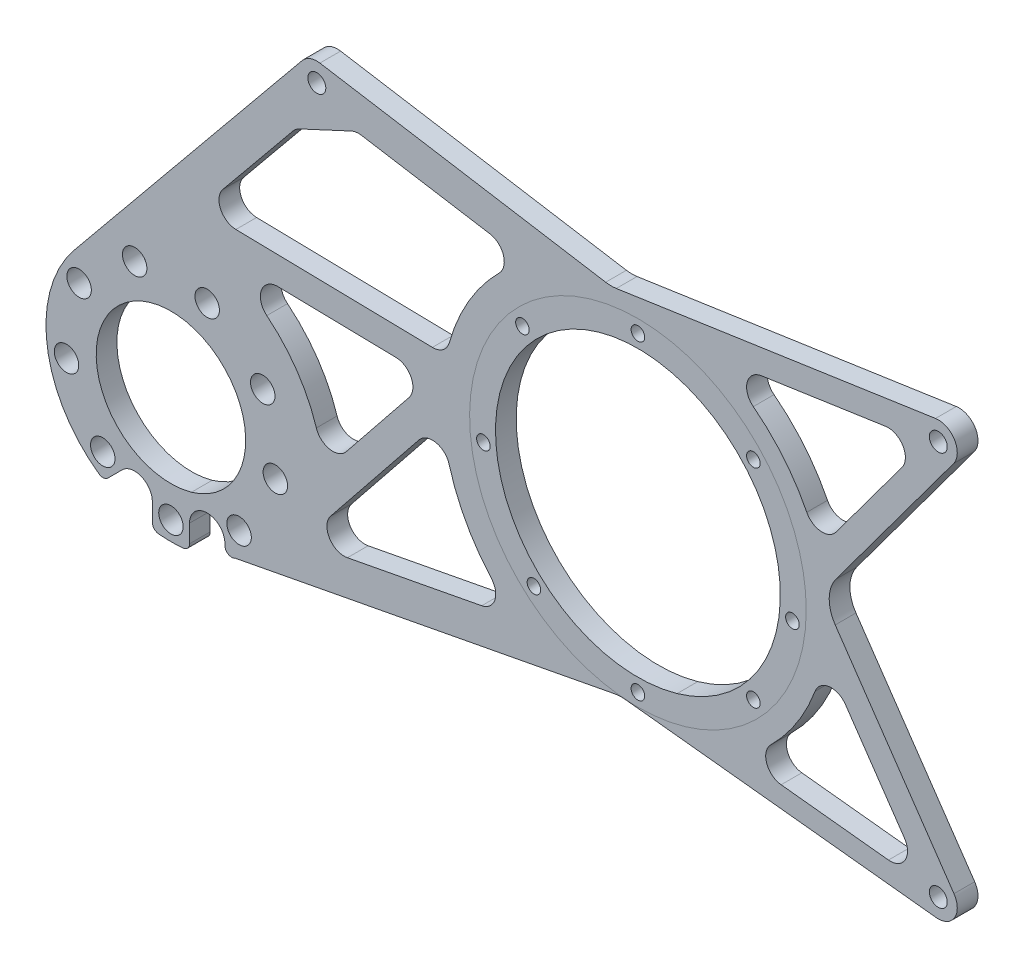
from build123d import *

# Parameters (mm, degrees)
SKETCH15_R          = 4.5
SKETCH15_R_2        = 27.4955
SKETCH15_R_3        = 2.5
SKETCH15_R_4        = 52.3875
SKETCH15_R_5        = 3.3
BOSS_EXTRUDE1_DEPTH = 7.62
PROFILE_DEPTH       = 804.110776731
PROF_FILLET_R       = 12.7
CUT_EXTRUDE2_DEPTH  = 804.110776731
FILLET2_R           = 6.35
CUT_EXTRUDE4_DEPTH  = 804.110776731
FILLET5_R           = 6.35


with BuildPart() as part:
    # Sketch15 → Boss-Extrude1 (new body)
    with BuildSketch(Plane(origin=(0, 0, 0), x_dir=(-1, 0, 0), z_dir=(0, 0, 1))):
        with BuildLine():
            ThreePointArc((-468.520845097, 164.597881552), (-470.201009111, 165.051242365), (-471.778645707, 164.316701751))
            Line((-471.778645707, 164.316701751), (-477.043529325, 159.051818133))
            ThreePointArc((-477.043529325, 159.051818133), (-484.127165713, 157.642795249), (-488.139723403, 163.648012211))
            Line((-488.139723403, 163.648012211), (-488.139723403, 170.220745001))
            ThreePointArc((-488.139723403, 170.220745001), (-488.796888696, 171.925600851), (-490.428332433, 172.748273949))
            ThreePointArc((-490.428332433, 172.748273949), (-494.978508993, 172.974), (-499.528685552, 172.748273949))
            ThreePointArc((-499.528685552, 172.748273949), (-501.160129289, 171.925600851), (-501.817294582, 170.220745001))
            Line((-501.817294582, 170.220745001), (-501.817294582, 163.648012211))
            ThreePointArc((-501.817294582, 163.648012211), (-508.317294582, 157.148012211), (-514.817294582, 163.648012211))
            Line((-514.817294582, 163.648012211), (-514.817294582, 164.225022653))
            ThreePointArc((-514.817294582, 164.225022653), (-516.106794745, 166.435870942), (-518.665995494, 166.401924563))
            Line((-518.665995494, 166.401924563), (-660.126842441, 139.458698233))
            Line((-660.126842441, 139.458698233), (-776.492771968, 151.978917225))
            ThreePointArc((-776.492771968, 151.978917225), (-781.907485254, 150.230614898), (-784.225, 145.034))
            Line((-784.225, 145.034), (-784.225, 0))
            ThreePointArc((-784.225, 0), (-782.179140867, -4.939140867), (-777.24, -6.985))
            Line((-777.24, -6.985), (-548.64, -6.985))
            ThreePointArc((-548.64, -6.985), (-545.651186694, -6.313257481), (-543.237237519, -4.427231931))
            Line((-543.237237519, -4.427231931), (-459.418508663, 97.860764379))
            ThreePointArc((-459.418508663, 97.860764379), (-449.426249212, 133.212914363), (-468.520845097, 164.597881552))
        make_face()
        with Locations((-508.317294582, 90.351987789)):
            Circle(SKETCH15_R, mode=Mode.SUBTRACT)
        with Locations((-481.639723403, 90.351987789)):
            Circle(SKETCH15_R, mode=Mode.SUBTRACT)
        with Locations((-528.75349974, 107.5)):
            Circle(SKETCH15_R, mode=Mode.SUBTRACT)
        with Locations((-461.203518245, 107.5)):
            Circle(SKETCH15_R, mode=Mode.SUBTRACT)
        with Locations((-533.38601136, 133.772278929)):
            Circle(SKETCH15_R, mode=Mode.SUBTRACT)
        with Locations((-494.978508993, 127)):
            Circle(SKETCH15_R_2, mode=Mode.SUBTRACT)
        with Locations((-456.571006625, 133.772278929)):
            Circle(SKETCH15_R, mode=Mode.SUBTRACT)
        with Locations((-520.04722577, 156.875733282)):
            Circle(SKETCH15_R, mode=Mode.SUBTRACT)
        with Locations((-494.978508993, 166)):
            Circle(SKETCH15_R, mode=Mode.SUBTRACT)
        with Locations((-469.909792215, 156.875733282)):
            Circle(SKETCH15_R, mode=Mode.SUBTRACT)
        with Locations((-609.91307368, 83.875279047)):
            Circle(SKETCH15_R_3, mode=Mode.SUBTRACT)
        with Locations((-666.75, 135.051477371)):
            Circle(SKETCH15_R_3, mode=Mode.SUBTRACT)
        with Locations((-666.75, 20.751477371)):
            Circle(SKETCH15_R_3, mode=Mode.SUBTRACT)
        with Locations((-709.220726776, 39.660663218)):
            Circle(SKETCH15_R_3, mode=Mode.SUBTRACT)
        with Locations((-624.279273224, 39.660663218)):
            Circle(SKETCH15_R_3, mode=Mode.SUBTRACT)
        with Locations((-666.75, 77.901477371)):
            Circle(SKETCH15_R_4, mode=Mode.SUBTRACT)
        with Locations((-723.58692632, 83.875279047)):
            Circle(SKETCH15_R_3, mode=Mode.SUBTRACT)
        with Locations((-709.220726776, 116.142291524)):
            Circle(SKETCH15_R_3, mode=Mode.SUBTRACT)
        with Locations((-628.509185847, 120.372204147)):
            Circle(SKETCH15_R_3, mode=Mode.SUBTRACT)
        with Locations((-548.64, 0)):
            Circle(SKETCH15_R_5, mode=Mode.SUBTRACT)
        with Locations((-777.24, 0)):
            Circle(SKETCH15_R_5, mode=Mode.SUBTRACT)
        with Locations((-777.24, 145.034)):
            Circle(SKETCH15_R_5, mode=Mode.SUBTRACT)
    extrude(amount=BOSS_EXTRUDE1_DEPTH)

    # Sketch18 → Profile (cut, through all)
    with BuildSketch(Plane.XY.offset(7.62)):
        with BuildLine():
            Line((656.843849148, -10.682497906), (776.22161066, 6.910362375))
            ThreePointArc((776.22161066, 6.910362375), (776.729439616, 6.966315604), (777.24, 6.985))
            Line((777.24, 6.985), (548.64, 6.985))
            ThreePointArc((548.64, 6.985), (549.207578223, 6.961902036), (549.771402717, 6.892760905))
            Line((549.771402717, 6.892760905), (656.843849148, -10.682497906))
        make_face()
        with BuildLine():
            Line((734.216175486, -69.849260886), (783.003068504, -141.087195416))
            ThreePointArc((783.003068504, -141.087195416), (783.91252795, -142.968183999), (784.225, -145.034))
            Line((784.225, -145.034), (784.225, 0))
            ThreePointArc((784.225, 0), (783.873353099, -2.188344502), (782.853818423, -4.156352694))
            Line((782.853818423, -4.156352694), (734.216175486, -69.849260886))
        make_face()
    extrude(amount=-PROFILE_DEPTH, mode=Mode.SUBTRACT)

    # Prof Fillet
    prof_fillet_edges = [part.edges().sort_by_distance(p)[0] for p in [
        (660.126842441, -139.458698233, 3.81),
        (734.216175486, -69.849260886, 3.81),
        (656.843849148, -10.682497906, 3.81),
    ]]
    fillet(prof_fillet_edges, radius=PROF_FILLET_R)

    # Sketch19 → Cut-Extrude2 (cut, through all)
    with BuildSketch(Plane.XY.offset(7.62)):
        with BuildLine():
            ThreePointArc((694.45302227, -14.12600314), (718.284506978, -31.22211205), (732.946816776, -56.623554423))
            Line((732.946816776, -56.623554423), (772.979141054, -2.553504053))
            Line((772.979141054, -2.553504053), (694.45302227, -14.12600314))
        make_face()
        with BuildLine():
            Line((772.613524345, -143.897556318), (735.318467656, -89.439839453))
            ThreePointArc((735.318467656, -89.439839453), (724.722491105, -116.293648856), (704.133403657, -136.529539656))
            Line((704.133403657, -136.529539656), (772.613524345, -143.897556318))
        make_face()
    extrude(amount=-CUT_EXTRUDE2_DEPTH, mode=Mode.SUBTRACT)

    # Fillet2
    fillet2_edges = [part.edges().sort_by_distance(p)[0] for p in [
        (694.45302227, -14.12600314, 3.81),
        (772.979141054, -2.553504053, 3.81),
        (732.946816776, -56.623554423, 3.81),
        (772.613524345, -143.897556318, 3.81),
        (704.133403657, -136.529539656, 3.81),
        (735.318467656, -89.439839453, 3.81),
    ]]
    fillet(fillet2_edges, radius=FILLET2_R)

    # Sketch22 → Cut-Extrude4 (cut, through all)
    with BuildSketch(Plane.XY.offset(7.62)):
        with BuildLine():
            Line((563.09944586, -8.164904037), (540.883041369, -18.482944043))
            Line((540.883041369, -18.482944043), (505.79558687, -61.301839836))
            Line((505.79558687, -61.301839836), (596.214449629, -63.096701449))
            ThreePointArc((596.214449629, -63.096701449), (606.783495422, -37.920687172), (625.959276135, -18.482944043))
            Line((625.959276135, -18.482944043), (563.09944586, -8.164904037))
        make_face()
        with BuildLine():
            Line((542.982722013, -148.842154434), (621.388723544, -133.908618474))
            ThreePointArc((621.388723544, -133.908618474), (603.082763934, -111.679107661), (594.94086334, -84.057218462))
            Line((594.94086334, -84.057218462), (542.982722013, -148.842154434))
        make_face()
        with BuildLine():
            Line((590.665799743, -73.148559395), (502.723422183, -71.402857307))
            ThreePointArc((502.723422183, -71.402857307), (535.868576594, -88.541862661), (550.94559886, -122.674400877))
            Line((550.94559886, -122.674400877), (590.665799743, -73.148559395))
        make_face()
    extrude(amount=-CUT_EXTRUDE4_DEPTH, mode=Mode.SUBTRACT)

    # Fillet5
    fillet5_edges = [part.edges().sort_by_distance(p)[0] for p in [
        (621.388723544, -133.908618474, 3.81),
        (542.982722013, -148.842154434, 3.81),
        (594.94086334, -84.057218462, 3.81),
        (550.94559886, -122.674400877, 3.81),
        (590.665799743, -73.148559395, 3.81),
        (502.723422183, -71.402857307, 3.81),
        (596.214449629, -63.096701449, 3.81),
        (505.79558687, -61.301839836, 3.81),
        (625.959276135, -18.482944043, 3.81),
        (563.09944586, -8.164904037, 3.81),
        (540.883041369, -18.482944043, 3.81),
    ]]
    fillet(fillet5_edges, radius=FILLET5_R)


solid = part.part
